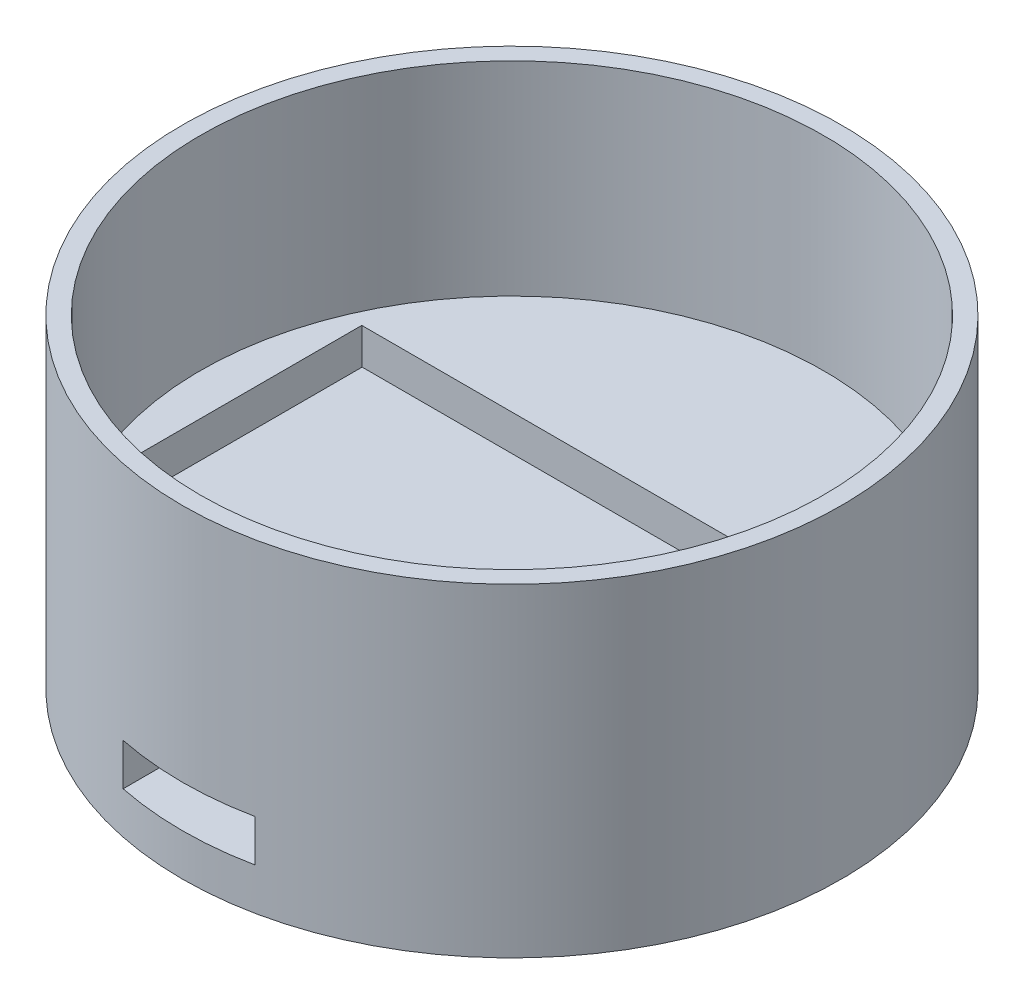
from build123d import *

# Parameters (mm, degrees)
SKETCH1_R           = 27.5
SKETCH1_R_2         = 26
BOSS_EXTRUDE1_DEPTH = 20
SKETCH1_3_R         = 26
BOSS_EXTRUDE2_DEPTH = 3
BOSS_EXTRUDE3_START = -7
SKETCH1_4_R         = 27.5
SKETCH1_4_W         = 0.030258968
SKETCH1_4_H         = 20
BOSS_EXTRUDE3_DEPTH = 7
SKETCH4_W           = 11
SKETCH4_H           = 3.5
CUT_EXTRUDE3_DEPTH  = 2.5
SKETCH4_2_W         = 11
SKETCH4_2_H         = 3.5
CUT_EXTRUDE4_DEPTH  = 51.621141828


with BuildPart() as part:
    # Sketch1 → Boss-Extrude1 (new body)
    with BuildSketch(Plane(origin=(0, 0, 0), x_dir=(1, 0, 0), z_dir=(0, 1, 0))):
        Circle(SKETCH1_R)
        Circle(SKETCH1_R_2, mode=Mode.SUBTRACT)
    extrude(amount=BOSS_EXTRUDE1_DEPTH)

    # Sketch1<3> → Boss-Extrude2 (add)
    with BuildSketch(Plane(origin=(0, 0, 0), x_dir=(1, 0, 0), z_dir=(0, 1, 0))):
        Circle(SKETCH1_3_R)
        Polygon((22.469741032, -10), (-22.5, -10), (-22.530258968, -10), (-22.530258968, 10), (-22.5, 10), (22.469741032, 10), align=None, mode=Mode.SUBTRACT)
    extrude(amount=BOSS_EXTRUDE2_DEPTH)

    # Sketch1<4> → Boss-Extrude3 (add)
    with BuildSketch(Plane(origin=(0, 0, 0), x_dir=(1, 0, 0), z_dir=(0, 1, 0)).offset(BOSS_EXTRUDE3_START)):
        Circle(SKETCH1_4_R)
        with Locations((-22.515129484, 0)):
            Rectangle(SKETCH1_4_W, SKETCH1_4_H, mode=Mode.SUBTRACT)
    extrude(amount=BOSS_EXTRUDE3_DEPTH)

    # Sketch4 → Cut-Extrude3 (cut, symmetric)
    with BuildSketch(Plane(origin=(0, 0, 10), x_dir=(-1, 0, 0), z_dir=(0, 0, -1))):
        with Locations((0, -1.75)):
            Rectangle(SKETCH4_W, SKETCH4_H)
    extrude(amount=CUT_EXTRUDE3_DEPTH, both=True, mode=Mode.SUBTRACT)

    # Sketch4<2> → Cut-Extrude4 (cut, through all)
    with BuildSketch(Plane(origin=(0, 0, 10), x_dir=(-1, 0, 0), z_dir=(0, 0, -1))):
        with Locations((0, -1.75)):
            Rectangle(SKETCH4_2_W, SKETCH4_2_H)
    extrude(amount=-CUT_EXTRUDE4_DEPTH, mode=Mode.SUBTRACT)


solid = part.part
